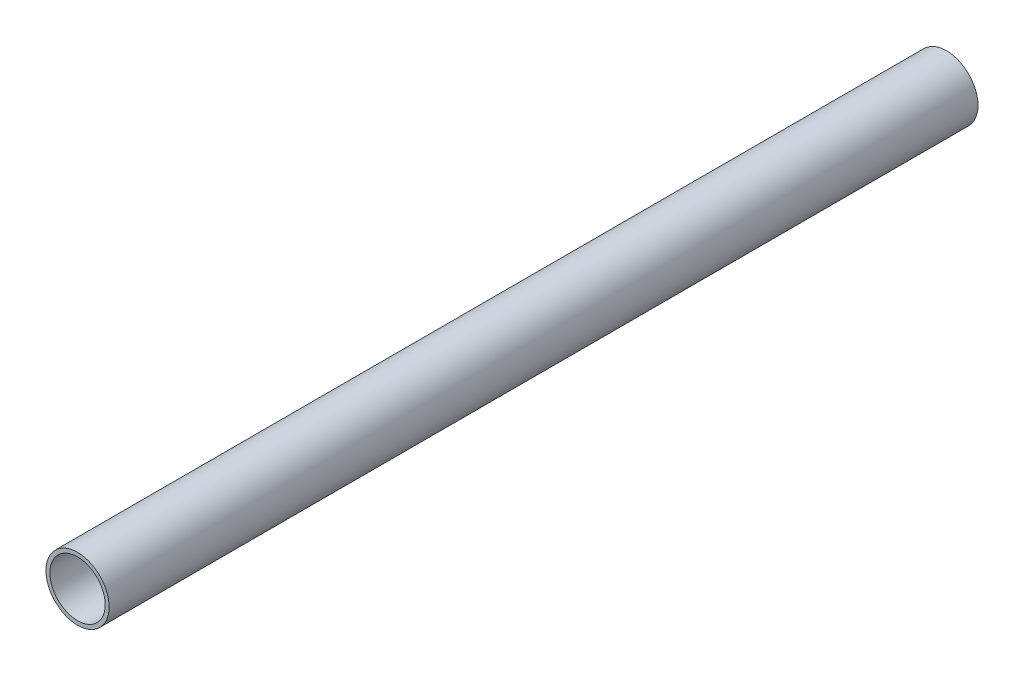
from build123d import *

# Parameters (mm, degrees)
SKETCH_1_R      = 8
SKETCH_1_R_2    = 7
EXTRUDE_1_DEPTH = 110


with BuildPart() as part:
    # 草图1 → 凸台-拉伸1 (new, symmetric)
    with BuildSketch(Plane.XY):
        Circle(SKETCH_1_R)
        Circle(SKETCH_1_R_2, mode=Mode.SUBTRACT)
    extrude(amount=EXTRUDE_1_DEPTH, both=True)


solid = part.part
